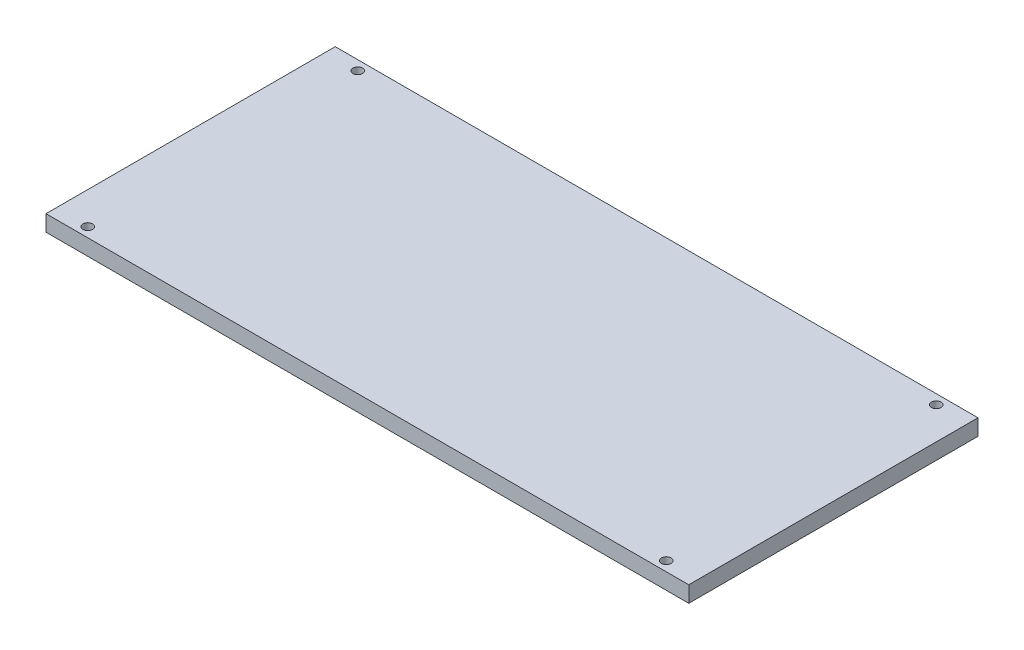
from build123d import *

# Parameters (mm, degrees)
SKETCH1_W           = 200
SKETCH1_H           = 90
SKETCH1_R           = 1.5
BOSS_EXTRUDE1_DEPTH = 5


with BuildPart() as part:
    # Sketch1 → Boss-Extrude1 (new body)
    with BuildSketch(Plane(origin=(0, 0, 0), x_dir=(1, 0, 0), z_dir=(0, 1, 0))):
        with Locations((3.97934472, -51.35784543)):
            Rectangle(SKETCH1_W, SKETCH1_H)
        with Locations(Location((-86.02065528, -9.35784543, 0), (0, 0, 270))):
            Circle(SKETCH1_R, mode=Mode.SUBTRACT)
        with Locations(Location((-86.02065528, -93.35784543, 0), (0, 0, 270))):
            Circle(SKETCH1_R, mode=Mode.SUBTRACT)
        with Locations(Location((93.97934472, -9.35784543, 0), (0, 0, 270))):
            Circle(SKETCH1_R, mode=Mode.SUBTRACT)
        with Locations(Location((93.97934472, -93.35784543, 0), (0, 0, 270))):
            Circle(SKETCH1_R, mode=Mode.SUBTRACT)
    extrude(amount=BOSS_EXTRUDE1_DEPTH)


solid = part.part
